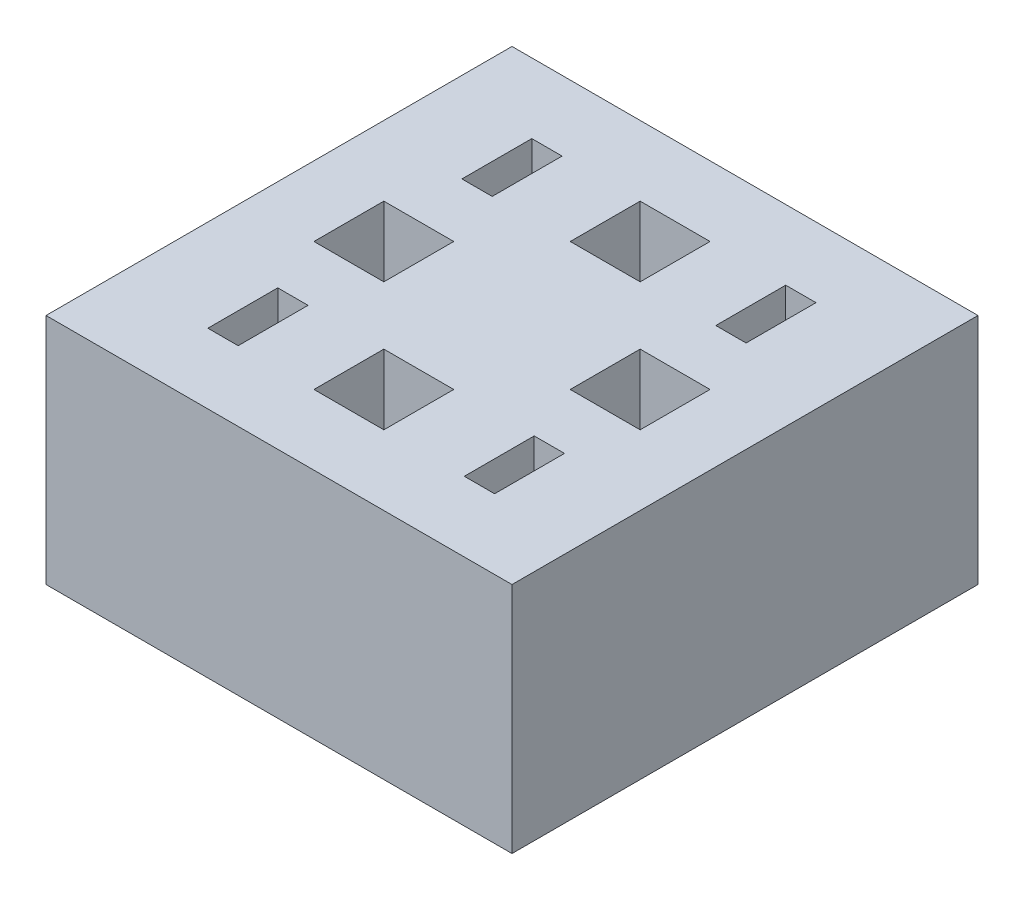
from build123d import *

# Parameters (mm, degrees)
SKETCH_208_W             = 40
SKETCH_208_H             = 40
SKETCH_208_W_2           = 6
SKETCH_208_H_2           = 6
EXTRUDE_1_DEPTH          = 10
SKETCH_1_W               = 40
SKETCH_1_H               = 40
SKETCH_1_W_2             = 3.5
SKETCH_1_H_2             = 7
SKETCH_1_W_3             = 7
SKETCH_1_H_3             = 3.5
EXTRUDE_5_DEPTH          = 10
CUT_EXTRUDE_1_DEPTH      = 31
CUT_EXTRUDE_1_DEPTH_BACK = 31
SKETCH_1_6_W             = 2.6
SKETCH_1_6_H             = 6
CUT_EXTRUDE_2_DEPTH      = 31
CUT_EXTRUDE_2_DEPTH_BACK = 31
SKETCH_1_7_W             = 2.6
SKETCH_1_7_H             = 6
CUT_EXTRUDE_3_DEPTH      = 31
CUT_EXTRUDE_3_DEPTH_BACK = 31
SKETCH_1_8_W             = 2.6
SKETCH_1_8_H             = 6
CUT_EXTRUDE_4_DEPTH      = 31
CUT_EXTRUDE_4_DEPTH_BACK = 31
SKETCH_1_9_W             = 2.6
SKETCH_1_9_H             = 6


with BuildPart() as part:
    # Sketch 208 → Бобышка-Вытянуть1 (new body)
    with BuildSketch(Plane(origin=(0, 0, 0), x_dir=(1, 0, 0), z_dir=(0, 1, 0))):
        Rectangle(SKETCH_208_W, SKETCH_208_H)
        with Locations((11, 0)):
            Rectangle(SKETCH_208_W_2, SKETCH_208_H_2, mode=Mode.SUBTRACT)
        with Locations((-11, 0)):
            Rectangle(SKETCH_208_W_2, SKETCH_208_H_2, mode=Mode.SUBTRACT)
        with Locations((0, -11)):
            Rectangle(SKETCH_208_W_2, SKETCH_208_H_2, mode=Mode.SUBTRACT)
        with Locations((0, 11)):
            Rectangle(SKETCH_208_W_2, SKETCH_208_H_2, mode=Mode.SUBTRACT)
    extrude(amount=EXTRUDE_1_DEPTH)

    # Эскиз1 → Бобышка-Вытянуть5 (add)
    with BuildSketch(Plane.XZ):
        Rectangle(SKETCH_1_W, SKETCH_1_H)
        with Locations((-3.25, -11)):
            Rectangle(SKETCH_1_W_2, SKETCH_1_H_2, mode=Mode.SUBTRACT)
        with Locations((3.25, -11)):
            Rectangle(SKETCH_1_W_2, SKETCH_1_H_2, mode=Mode.SUBTRACT)
        with Locations((-11, -3.25)):
            Rectangle(SKETCH_1_W_3, SKETCH_1_H_3, mode=Mode.SUBTRACT)
        with Locations((-11, 3.25)):
            Rectangle(SKETCH_1_W_3, SKETCH_1_H_3, mode=Mode.SUBTRACT)
        with Locations((11, 3.25)):
            Rectangle(SKETCH_1_W_3, SKETCH_1_H_3, mode=Mode.SUBTRACT)
        with Locations((11, -3.25)):
            Rectangle(SKETCH_1_W_3, SKETCH_1_H_3, mode=Mode.SUBTRACT)
        with Locations((-3.25, 11)):
            Rectangle(SKETCH_1_W_2, SKETCH_1_H_2, mode=Mode.SUBTRACT)
        with Locations((3.25, 11)):
            Rectangle(SKETCH_1_W_2, SKETCH_1_H_2, mode=Mode.SUBTRACT)
    extrude(amount=EXTRUDE_5_DEPTH)

    # Эскиз1<6> → Вырез-Вытянуть1 (cut, two sides: drawn at the far end of the back side and taken through both)
    with BuildSketch(Plane.XZ.offset(-CUT_EXTRUDE_1_DEPTH_BACK)):
        with Locations((-10.806551552, 11)):
            Rectangle(SKETCH_1_6_W, SKETCH_1_6_H)
    extrude(amount=CUT_EXTRUDE_1_DEPTH + CUT_EXTRUDE_1_DEPTH_BACK, mode=Mode.SUBTRACT)

    # Эскиз1<7> → Вырез-Вытянуть2 (cut, two sides: drawn at the far end of the back side and taken through both)
    with BuildSketch(Plane.XZ.offset(-CUT_EXTRUDE_2_DEPTH_BACK)):
        with Locations((11.206646971, 11)):
            Rectangle(SKETCH_1_7_W, SKETCH_1_7_H)
    extrude(amount=CUT_EXTRUDE_2_DEPTH + CUT_EXTRUDE_2_DEPTH_BACK, mode=Mode.SUBTRACT)

    # Эскиз1<8> → Вырез-Вытянуть3 (cut, two sides: drawn at the far end of the back side and taken through both)
    with BuildSketch(Plane.XZ.offset(-CUT_EXTRUDE_3_DEPTH_BACK)):
        with Locations((10.793353029, -11)):
            Rectangle(SKETCH_1_8_W, SKETCH_1_8_H)
    extrude(amount=CUT_EXTRUDE_3_DEPTH + CUT_EXTRUDE_3_DEPTH_BACK, mode=Mode.SUBTRACT)

    # Эскиз1<9> → Вырез-Вытянуть4 (cut, two sides: drawn at the far end of the back side and taken through both)
    with BuildSketch(Plane.XZ.offset(-CUT_EXTRUDE_4_DEPTH_BACK)):
        with Locations((-11, -11)):
            Rectangle(SKETCH_1_9_W, SKETCH_1_9_H)
    extrude(amount=CUT_EXTRUDE_4_DEPTH + CUT_EXTRUDE_4_DEPTH_BACK, mode=Mode.SUBTRACT)


solid = part.part
